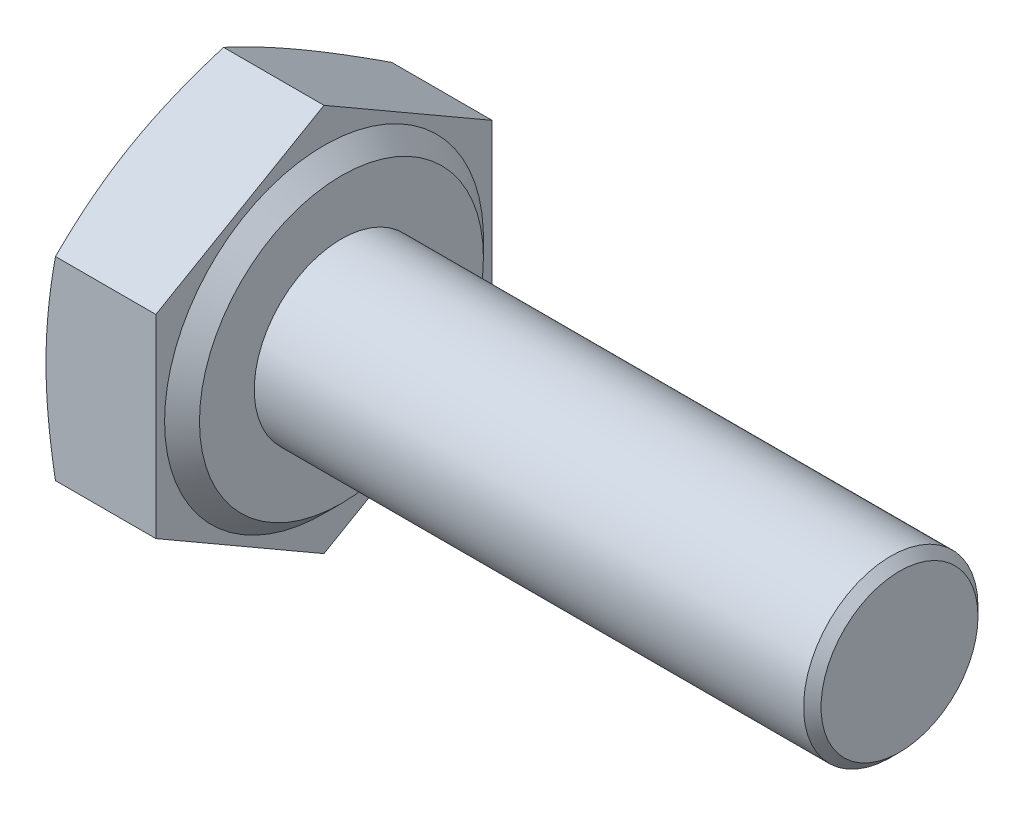
from build123d import *

# Parameters (mm, degrees)
BASEHEAD_DEPTH = 1.825
SKETCH5_R      = 1.25
BASEBODY_DEPTH = 8
CHAMFER1_SIZE  = 0.125


with BuildPart() as part:
    # Sketch2 → BaseHead (new body)
    with BuildSketch(Plane(origin=(0, 0, 0), x_dir=(0, 0, -1), z_dir=(1, 0, 0))):
        Polygon((2.41, -1.391414149), (2.41, 1.391414149), (0, 2.782828297), (-2.41, 1.391414149), (-2.41, -1.391414149), (0, -2.782828297), align=None)
    extrude(amount=BASEHEAD_DEPTH)

    # Sketch3 → BearingFace (revolve, cut)
    with BuildSketch(Plane.XY, mode=Mode.PRIVATE) as bearingface_sk:
        Polygon((1.825, 2.782828297), (1.825, 2.035), (1.575, 2.285), (1.575, 2.782828297), align=None)
    revolve(bearingface_sk.sketch.rotate(Axis((-0.957090588, 0, 0), (1, 0, 0)), 90), axis=Axis((-0.957090588, 0, 0), (1, 0, 0)), mode=Mode.SUBTRACT)

    # Sketch4 → HeadChamfer (revolve, cut)
    with BuildSketch(Plane.XY):
        Polygon((0, 2.782828297), (0.135698403, 2.782828297), (0, 2.41), align=None)
    revolve(axis=Axis((-0.493528746, 0, 0), (1, 0, 0)), mode=Mode.SUBTRACT)

    # Sketch5 → BaseBody (add)
    with BuildSketch(Plane(origin=(1.825, 0, 0), x_dir=(0, 0, -1), z_dir=(1, 0, 0))):
        Circle(SKETCH5_R)
    extrude(amount=BASEBODY_DEPTH)

    # Chamfer1
    chamfer1_edges = [part.edges().sort_by_distance(p)[0] for p in [
        (9.825, 0, 1.25),
    ]]
    chamfer(chamfer1_edges, length=CHAMFER1_SIZE)


solid = part.part
